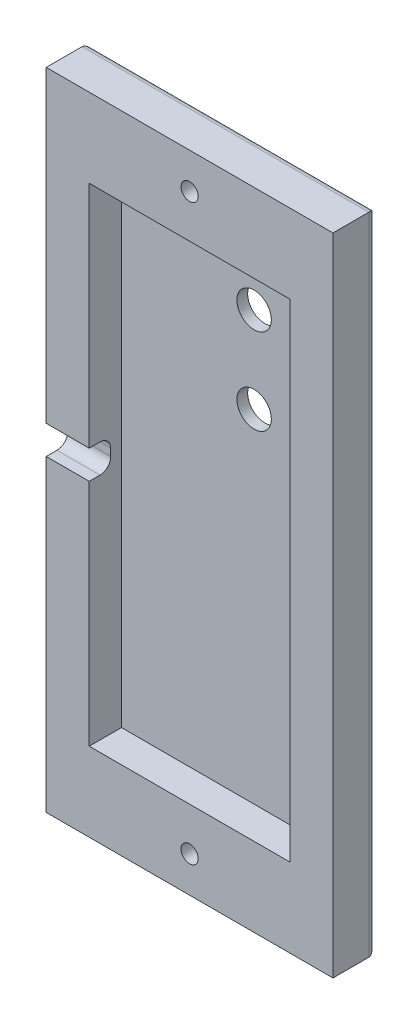
from build123d import *

# Parameters (mm, degrees)
SKETCH1_W           = 90
SKETCH1_H           = 40
BOSS_EXTRUDE1_DEPTH = 6
SKETCH2_W           = 28
SKETCH2_H           = 68
CUT_EXTRUDE1_DEPTH  = 4.5
SKETCH6_R           = 1.2
CUT_EXTRUDE5_DEPTH  = 99.671171068
SKETCH7_R           = 1.2
CUT_EXTRUDE6_DEPTH  = 99.671171068
SKETCH8_R           = 2.4
CUT_EXTRUDE7_DEPTH  = 99.591328219
SKETCH9_R           = 2.15
CUT_EXTRUDE8_DEPTH  = 2.4
FILLET3_R           = 1
SKETCH10_W          = 4
SKETCH10_H          = 3
CUT_EXTRUDE9_DEPTH  = 10
FILLET4_R           = 1.5


with BuildPart() as part:
    # Sketch1 → Boss-Extrude1 (new body)
    with BuildSketch(Plane(origin=(0, 0, 0), x_dir=(0, 1, 0), z_dir=(0, 0, 1))):
        with Locations((45, 20)):
            Rectangle(SKETCH1_W, SKETCH1_H)
    extrude(amount=BOSS_EXTRUDE1_DEPTH)

    # Sketch2 → Cut-Extrude1 (cut)
    with BuildSketch(Plane.XY.offset(6)):
        with Locations((-20, 45)):
            Rectangle(SKETCH2_W, SKETCH2_H)
    extrude(amount=-CUT_EXTRUDE1_DEPTH, mode=Mode.SUBTRACT)

    # Sketch6 → Cut-Extrude5 (cut, through all)
    with BuildSketch(Plane.XY.offset(6)):
        with Locations((-20, 85)):
            Circle(SKETCH6_R)
    extrude(amount=-CUT_EXTRUDE5_DEPTH, mode=Mode.SUBTRACT)

    # Sketch7 → Cut-Extrude6 (cut, through all)
    with BuildSketch(Plane.XY.offset(6)):
        with Locations((-20, 5)):
            Circle(SKETCH7_R)
    extrude(amount=-CUT_EXTRUDE6_DEPTH, mode=Mode.SUBTRACT)

    # Sketch8 → Cut-Extrude7 (cut, through all)
    with BuildSketch(Plane.XY.offset(1.5)):
        with Locations((-15.5, 70.7)):
            Circle(SKETCH8_R)
        with Locations((-15.5, 58.7)):
            Circle(SKETCH8_R)
    extrude(amount=-CUT_EXTRUDE7_DEPTH, mode=Mode.SUBTRACT)

    # Sketch9 → Cut-Extrude8 (cut)
    with BuildSketch(Plane(origin=(0, 0, 0), x_dir=(1, 0, 0), z_dir=(0, 0, -1))):
        with Locations(Location((-20, -5, 0), (0, 0, 180))):
            Circle(SKETCH9_R)
        with Locations(Location((-20, -85, 0), (0, 0, 180))):
            Circle(SKETCH9_R)
    extrude(amount=-CUT_EXTRUDE8_DEPTH, mode=Mode.SUBTRACT)

    # Fillet3
    fillet3_edges = [part.edges().sort_by_distance(p)[0] for p in [
        (-40, 45, 0),
        (-20, 90, 0),
        (0, 45, 0),
        (-20, 0, 0),
    ]]
    fillet(fillet3_edges, radius=FILLET3_R)

    # Sketch10 → Cut-Extrude9 (cut)
    with BuildSketch(Plane(origin=(-40, 0, 0), x_dir=(0, -1, 0), z_dir=(-1, 0, 0))):
        with Locations((-45, 4.5)):
            Rectangle(SKETCH10_W, SKETCH10_H)
    extrude(amount=-CUT_EXTRUDE9_DEPTH, mode=Mode.SUBTRACT)

    # Fillet4
    fillet4_edges = [part.edges().sort_by_distance(p)[0] for p in [
        (-37, 47, 3),
        (-37, 43, 3),
    ]]
    fillet(fillet4_edges, radius=FILLET4_R)


solid = part.part
